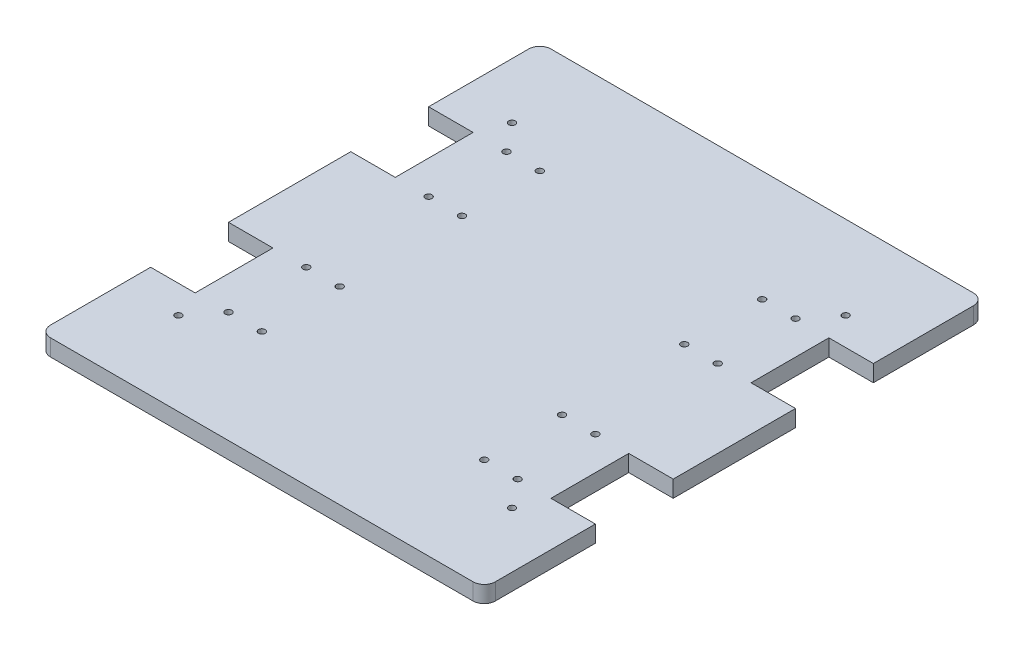
from build123d import *

# Parameters (mm, degrees)
EXTRUDE_1_DEPTH     = 15
SKETCH_3_R          = 3
CUT_EXTRUDE_1_DEPTH = 15


with BuildPart() as part:
    # 草圖1 → 填料-伸長1 (new body)
    with BuildSketch(Plane(origin=(0, 0, 0), x_dir=(1, 0, 0), z_dir=(0, 1, 0))):
        with BuildLine():
            Line((-200, 55), (-200, -55))
            Line((-200, -55), (-160, -55))
            Line((-160, -55), (-160, -125))
            Line((-160, -125), (-200, -125))
            Line((-200, -125), (-200, -215))
            ThreePointArc((-200, -215), (-197.071067812, -222.071067812), (-190, -225))
            Line((-190, -225), (190, -225))
            ThreePointArc((190, -225), (197.071067812, -222.071067812), (200, -215))
            Line((200, -215), (200, -125))
            Line((200, -125), (160, -125))
            Line((160, -125), (160, -55))
            Line((160, -55), (200, -55))
            Line((200, -55), (200, 55))
            Line((200, 55), (160, 55))
            Line((160, 55), (160, 125))
            Line((160, 125), (200, 125))
            Line((200, 125), (200, 215))
            ThreePointArc((200, 215), (197.071067812, 222.071067812), (190, 225))
            Line((190, 225), (-190, 225))
            ThreePointArc((-190, 225), (-197.071067812, 222.071067812), (-200, 215))
            Line((-200, 215), (-200, 125))
            Line((-200, 125), (-160, 125))
            Line((-160, 125), (-160, 55))
            Line((-160, 55), (-200, 55))
        make_face()
    extrude(amount=EXTRUDE_1_DEPTH)

    # 草圖3 → 除料-伸長1 (cut)
    with BuildSketch(Plane(origin=(0, 15, 0), x_dir=(1, 0, 0), z_dir=(0, 1, 0))):
        with Locations(Location((-130, 125, 0), (0, 0, 270))):
            Circle(SKETCH_3_R)
        with Locations(Location((-100, 125, 0), (0, 0, 270))):
            Circle(SKETCH_3_R)
        with Locations(Location((-100, 55, 0), (0, 0, 90))):
            Circle(SKETCH_3_R)
        with Locations(Location((-130, 55, 0), (0, 0, 90))):
            Circle(SKETCH_3_R)
        with Locations(Location((100, 55, 0), (0, 0, 270))):
            Circle(SKETCH_3_R)
        with Locations(Location((130, 55, 0), (0, 0, 270))):
            Circle(SKETCH_3_R)
        with Locations(Location((100, 125, 0), (0, 0, 90))):
            Circle(SKETCH_3_R)
        with Locations(Location((130, 125, 0), (0, 0, 90))):
            Circle(SKETCH_3_R)
        with Locations(Location((100, -125, 0), (0, 0, 270))):
            Circle(SKETCH_3_R)
        with Locations(Location((130, -125, 0), (0, 0, 270))):
            Circle(SKETCH_3_R)
        with Locations(Location((130, -55, 0), (0, 0, 90))):
            Circle(SKETCH_3_R)
        with Locations(Location((100, -55, 0), (0, 0, 90))):
            Circle(SKETCH_3_R)
        with Locations(Location((-100, -55, 0), (0, 0, 270))):
            Circle(SKETCH_3_R)
        with Locations(Location((-130, -55, 0), (0, 0, 270))):
            Circle(SKETCH_3_R)
        with Locations(Location((-100, -125, 0), (0, 0, 90))):
            Circle(SKETCH_3_R)
        with Locations(Location((-130, -125, 0), (0, 0, 90))):
            Circle(SKETCH_3_R)
        with Locations(Location((-150, -150, 0), (0, 0, 270))):
            Circle(SKETCH_3_R)
        with Locations(Location((150, -150, 0), (0, 0, 270))):
            Circle(SKETCH_3_R)
        with Locations(Location((150, 150, 0), (0, 0, 270))):
            Circle(SKETCH_3_R)
        with Locations(Location((-150, 150, 0), (0, 0, 270))):
            Circle(SKETCH_3_R)
    extrude(amount=-CUT_EXTRUDE_1_DEPTH, mode=Mode.SUBTRACT)


solid = part.part
